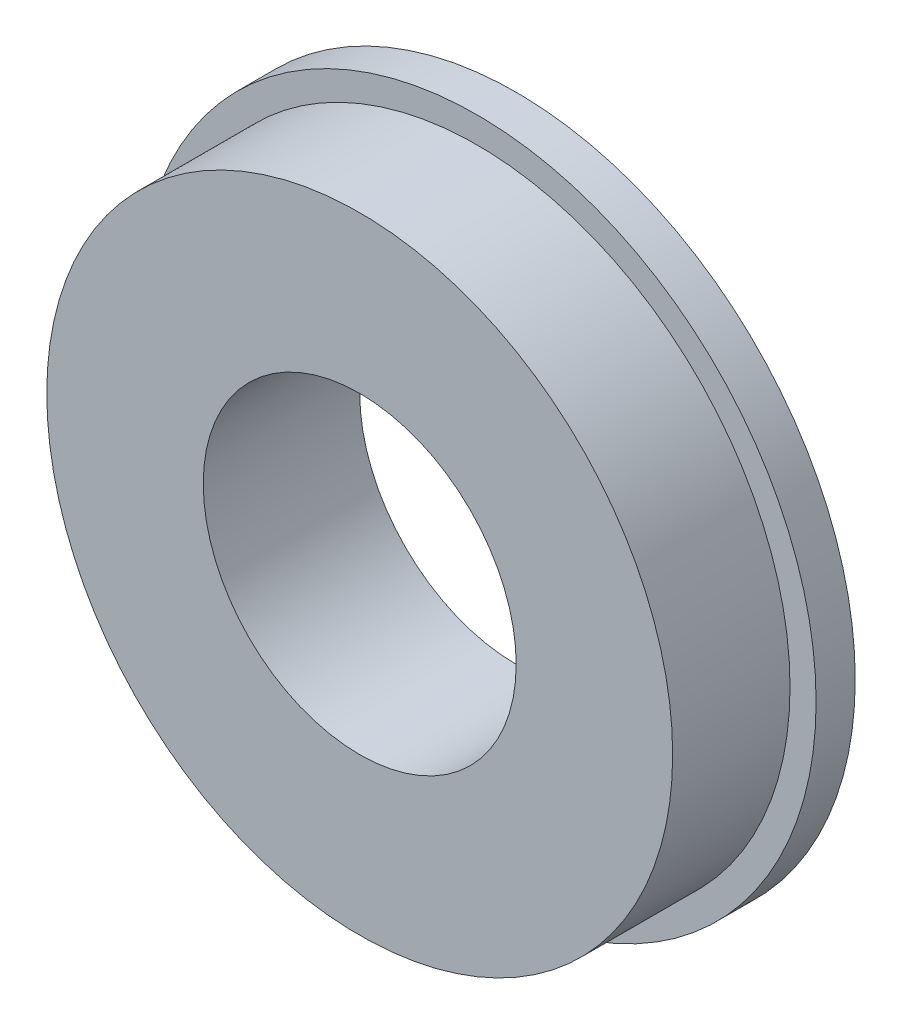
from build123d import *

# Parameters (mm, degrees)
SKETCH1_R           = 13
BOSS_EXTRUDE1_DEPTH = 1.5
SKETCH2_R           = 12
BOSS_EXTRUDE2_DEPTH = 4.5
SKETCH3_R           = 6
CUT_EXTRUDE1_DEPTH  = 20.339079606


with BuildPart() as part:
    # Sketch1 → Boss-Extrude1 (new body)
    with BuildSketch(Plane.XY):
        Circle(SKETCH1_R)
    extrude(amount=BOSS_EXTRUDE1_DEPTH)

    # Sketch2 → Boss-Extrude2 (add)
    with BuildSketch(Plane.XY.offset(1.5)):
        Circle(SKETCH2_R)
    extrude(amount=BOSS_EXTRUDE2_DEPTH)

    # Sketch3 → Cut-Extrude1 (cut, through all)
    with BuildSketch(Plane.XY.offset(6)):
        Circle(SKETCH3_R)
    extrude(amount=-CUT_EXTRUDE1_DEPTH, mode=Mode.SUBTRACT)


solid = part.part
